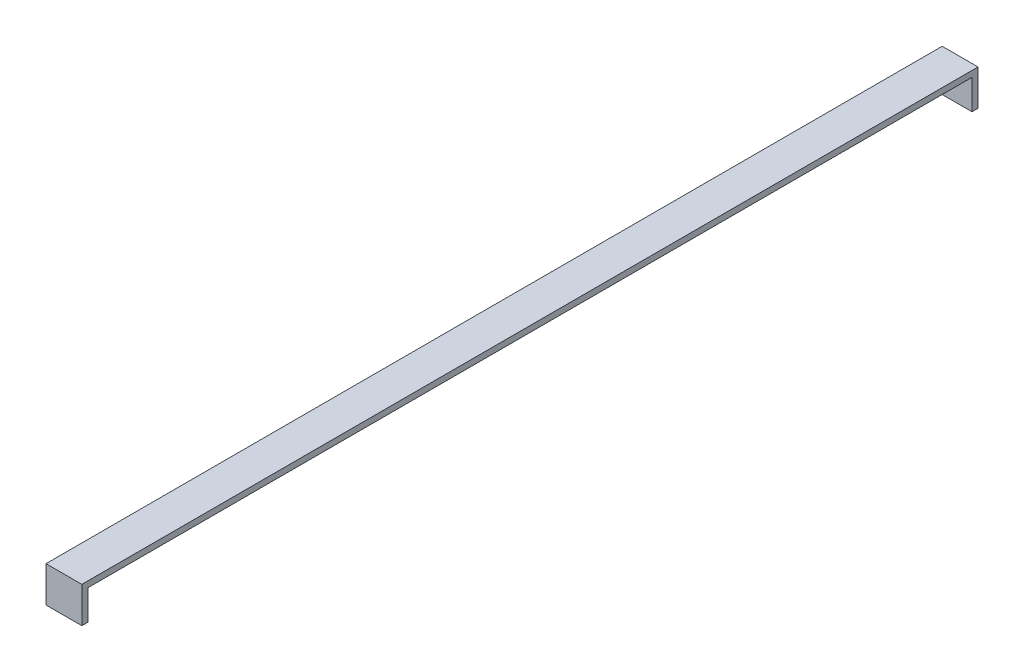
from build123d import *

# Parameters (mm, degrees)
EXTRUDE_1_DEPTH = 6


with BuildPart() as part:
    # 草图1 → 凸台-拉伸1 (new body)
    with BuildSketch(Plane(origin=(0, 0, 0), x_dir=(0, 0, -1), z_dir=(1, 0, 0))):
        Polygon((81.370903679, 14.570954893), (82.370903679, 14.570954893), (82.370903679, 20.570954893), (-67.629096321, 20.570954893), (-67.629096321, 14.570954893), (-66.629096321, 14.570954893), (-66.629096321, 19.570954893), (81.370903679, 19.570954893), align=None)
    extrude(amount=EXTRUDE_1_DEPTH)


solid = part.part
